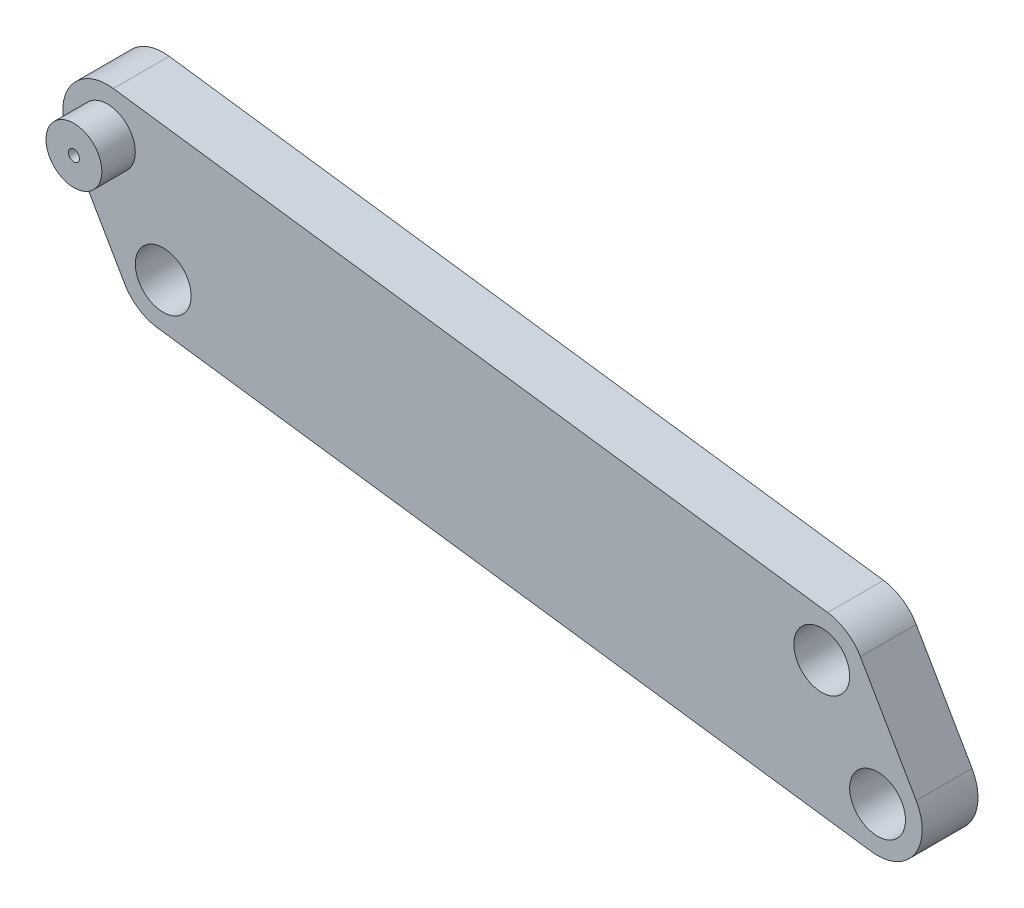
from build123d import *

# Parameters (mm, degrees)
SKETCH2_R           = 2.5
BOSS_EXTRUDE1_DEPTH = 5
SKETCH4_R           = 2.5
SKETCH4_R_2         = 0.5
BOSS_EXTRUDE3_DEPTH = 8


with BuildPart() as part:
    # Sketch2 → Boss-Extrude1 (new body)
    with BuildSketch(Plane.XY):
        with BuildLine():
            Line((-63.463622529, 12.624128305), (0.536377471, 3.963874268))
            ThreePointArc((0.536377471, 3.963874268), (2.228263621, 3.321873152), (3.464101615, 2))
            Line((3.464101615, 2), (8.464101615, -6.660254038))
            ThreePointArc((8.464101615, -6.660254038), (8.321873152, -10.888517659), (4.463622529, -12.624128305))
            Line((4.463622529, -12.624128305), (-59.536377471, -3.963874268))
            ThreePointArc((-59.536377471, -3.963874268), (-61.228263621, -3.321873152), (-62.464101615, -2))
            Line((-62.464101615, -2), (-67.464101615, 6.660254038))
            ThreePointArc((-67.464101615, 6.660254038), (-67.321873152, 10.888517659), (-63.463622529, 12.624128305))
        make_face()
        with Locations((-59, 0)):
            Circle(SKETCH2_R, mode=Mode.SUBTRACT)
        with Locations((-64, 8.660254038)):
            Circle(SKETCH2_R, mode=Mode.SUBTRACT)
        Circle(SKETCH2_R, mode=Mode.SUBTRACT)
        with Locations((5, -8.660254038)):
            Circle(SKETCH2_R, mode=Mode.SUBTRACT)
    extrude(amount=BOSS_EXTRUDE1_DEPTH)

    # Sketch4 → Boss-Extrude3 (add)
    with BuildSketch(Plane(origin=(0, 0, 0), x_dir=(-1, 0, 0), z_dir=(0, 0, -1))):
        with Locations((64, 8.660254038)):
            Circle(SKETCH4_R)
        with Locations((64, 8.660254038)):
            Circle(SKETCH4_R_2, mode=Mode.SUBTRACT)
    extrude(amount=-BOSS_EXTRUDE3_DEPTH)


solid = part.part
